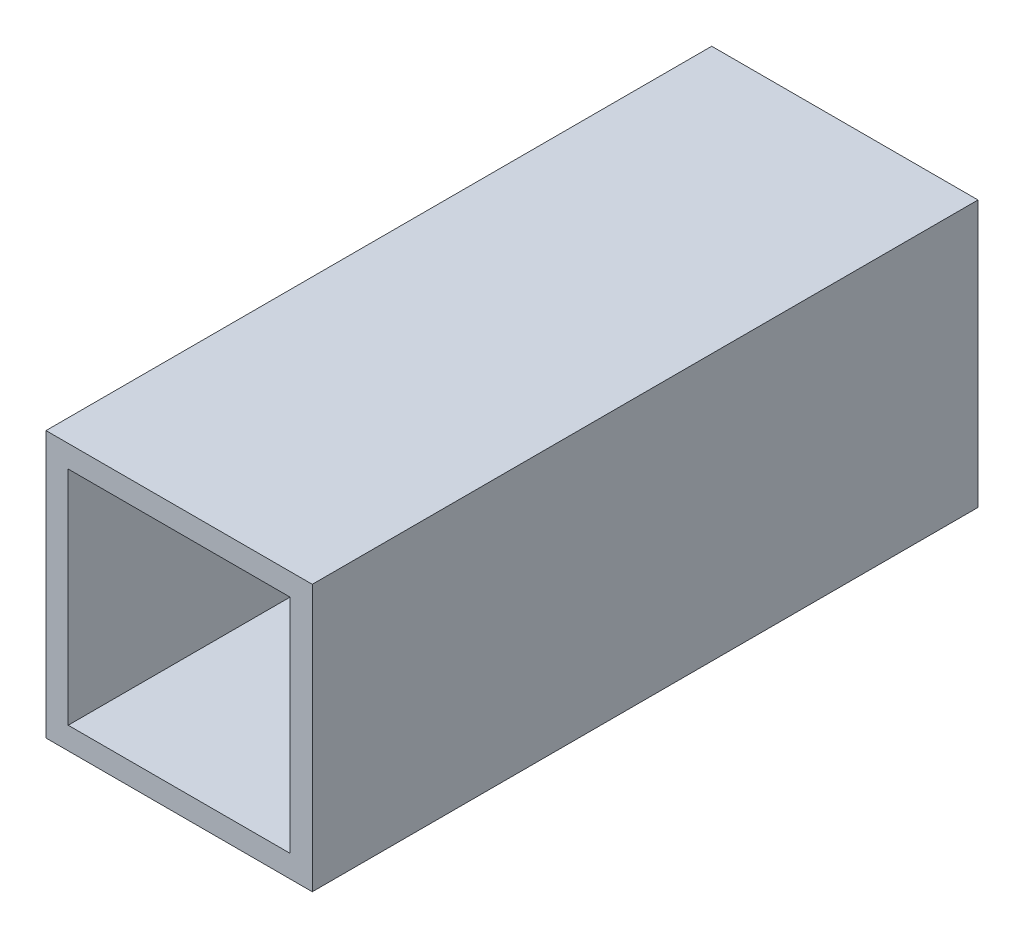
from build123d import *

# Parameters (mm, degrees)
SKETCH_1_W      = 24
SKETCH_1_H      = 24
SKETCH_1_W_2    = 20
SKETCH_1_H_2    = 20
EXTRUDE_1_DEPTH = 60


with BuildPart() as part:
    # 草图1 → 凸台-拉伸1 (new body)
    with BuildSketch(Plane.XY):
        Rectangle(SKETCH_1_W, SKETCH_1_H)
        Rectangle(SKETCH_1_W_2, SKETCH_1_H_2, mode=Mode.SUBTRACT)
    extrude(amount=EXTRUDE_1_DEPTH)


solid = part.part
